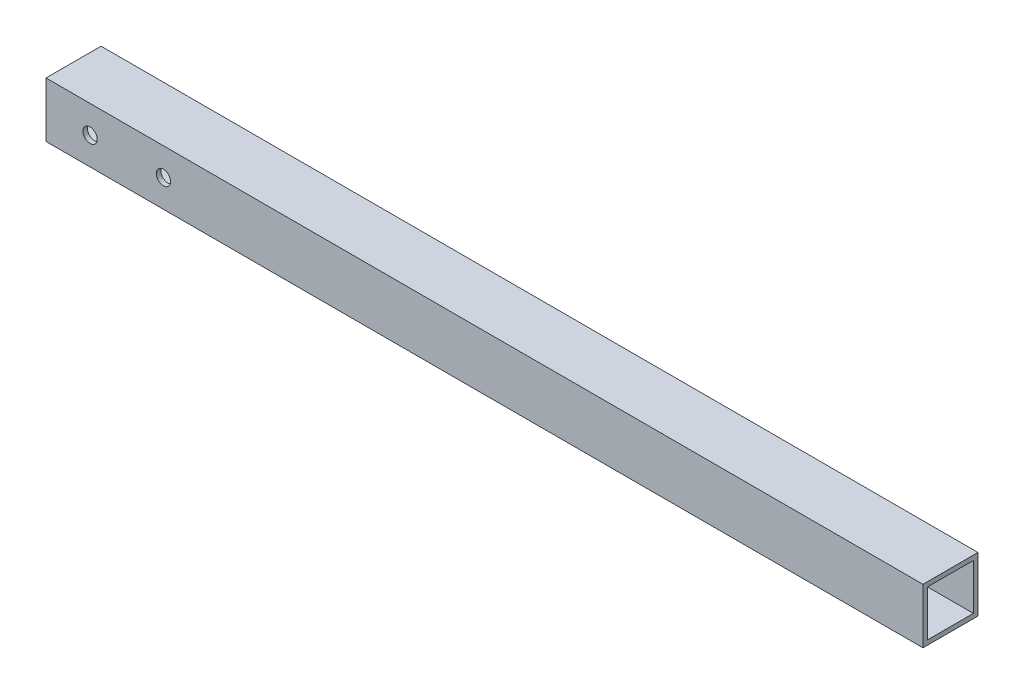
from build123d import *

# Parameters (mm, degrees)
SKETCH1_W           = 15
SKETCH1_H           = 15
SKETCH1_W_2         = 12.5
SKETCH1_H_2         = 12.5
BOSS_EXTRUDE1_DEPTH = 238.95
SKETCH2_R           = 1.95
CUT_EXTRUDE1_DEPTH  = 240.537789294
SKETCH5_R           = 3.75
SKETCH5_R_2         = 2
CUT_EXTRUDE6_DEPTH  = 5


with BuildPart() as part:
    # Sketch1 → Boss-Extrude1 (new body)
    with BuildSketch(Plane(origin=(0, 0, 0), x_dir=(0, 0, -1), z_dir=(1, 0, 0))):
        Rectangle(SKETCH1_W, SKETCH1_H)
        Rectangle(SKETCH1_W_2, SKETCH1_H_2, mode=Mode.SUBTRACT)
    extrude(amount=BOSS_EXTRUDE1_DEPTH)

    # Sketch2 → Cut-Extrude1 (cut, through all)
    with BuildSketch(Plane(origin=(0, 0, -7.5), x_dir=(-1, 0, 0), z_dir=(0, 0, -1))):
        with Locations(Location((-12.000000001, 0, 0), (0, 0, 90))):
            Circle(SKETCH2_R)
        with Locations(Location((-32.000000001, 0, 0), (0, 0, 90))):
            Circle(SKETCH2_R)
    extrude(amount=-CUT_EXTRUDE1_DEPTH, mode=Mode.SUBTRACT)

    # Sketch5 → Cut-Extrude6 (cut)
    with BuildSketch(Plane.XZ.offset(7.5)):
        with Locations(Location((64.7, 0, 0), (0, 0, 270))):
            Circle(SKETCH5_R)
        with Locations(Location((228.95, 0, 0), (0, 0, 270))):
            Circle(SKETCH5_R_2)
    extrude(amount=-CUT_EXTRUDE6_DEPTH, mode=Mode.SUBTRACT)


solid = part.part
